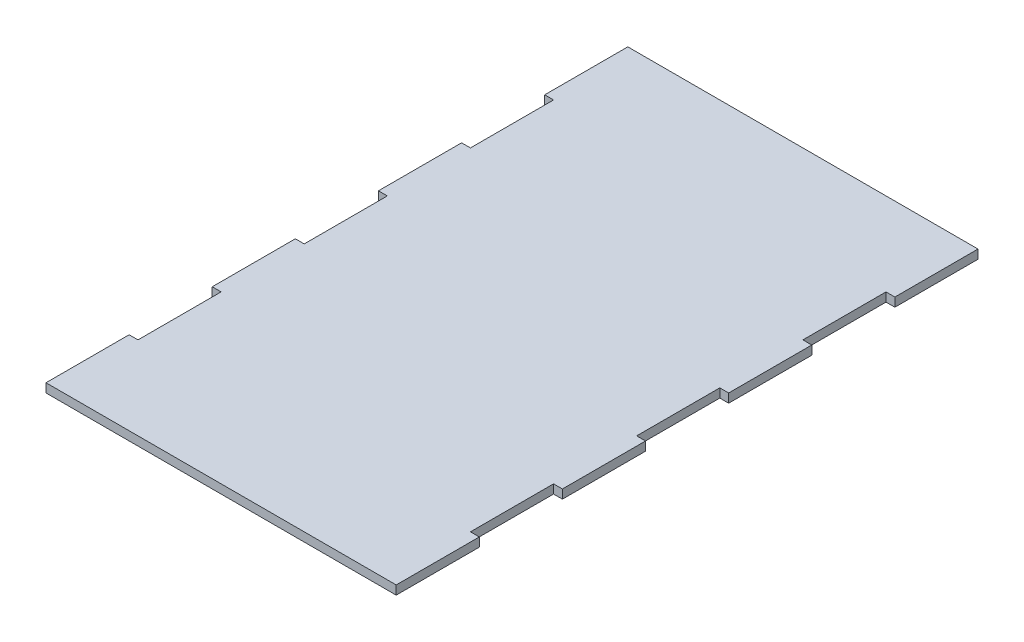
from build123d import *

# Parameters (mm, degrees)
BOSS_EXTRUDE1_DEPTH = 10.16


with BuildPart() as part:
    # Sketch1 → Boss-Extrude1 (new body)
    with BuildSketch(Plane(origin=(0, 0, 0), x_dir=(1, 0, 0), z_dir=(0, 1, 0))):
        Polygon((0, 666.75), (0, 571.5), (10.16, 571.5), (10.16, 476.25), (0, 476.25), (0, 381), (10.16, 381), (10.16, 285.75), (0, 285.75), (0, 190.5), (10.16, 190.5), (10.16, 95.25), (0, 95.25), (0, 0), (401.32, 0), (401.32, 95.25), (391.16, 95.25), (391.16, 190.5), (401.32, 190.5), (401.32, 285.75), (391.16, 285.75), (391.16, 381), (401.32, 381), (401.32, 476.25), (391.16, 476.25), (391.16, 571.5), (401.32, 571.5), (401.32, 666.75), align=None)
    extrude(amount=BOSS_EXTRUDE1_DEPTH)


solid = part.part
